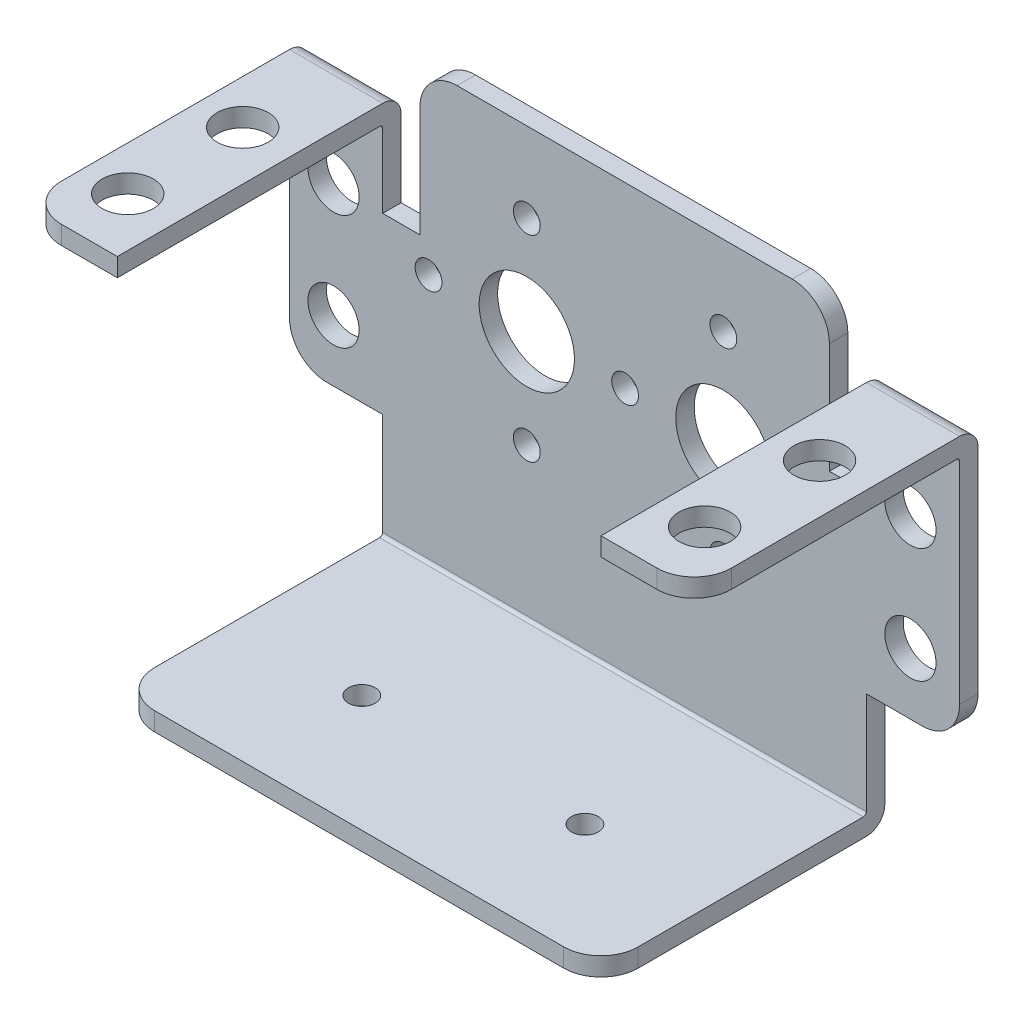
from build123d import *

# Parameters (mm, degrees)
SKETCH1_R      = 4.064
SKETCH1_R_2    = 1.143
SKETCH1_R_3    = 2.1844
EXTRUDE2_DEPTH = 1.5748
SKETCH3_W      = 7.9502
SKETCH3_H      = 1.5748
SKETCH3_W_2    = 41.2496
EXTRUDE3_DEPTH = 22.6314
FILLET1_R      = 3.175
FILLET2_R      = 1.5748
FILLET3_R      = 0.254
SKETCH4_R      = 1.143
EXTRUDE4_DEPTH = 1.5748
SKETCH5_R      = 2.1844
EXTRUDE5_DEPTH = 1.5748


with BuildPart() as part:
    # Sketch1 → Extrude2 (new body)
    with BuildSketch(Plane.XY):
        with BuildLine():
            Line((11.9126, 30.734), (11.9126, 34.835994844))
            ThreePointArc((11.9126, 34.835994844), (12.84253597, 37.081058874), (15.0876, 38.010994844))
            Line((15.0876, 38.010994844), (43.6626, 38.010994844))
            ThreePointArc((43.6626, 38.010994844), (45.90766403, 37.081058874), (46.8376, 34.835994844))
            Line((46.8376, 34.835994844), (46.8376, 33.528))
            Line((46.8376, 33.528), (46.8376, 25.4))
            Line((46.8376, 25.4), (49.9872, 25.4))
            Line((49.9872, 25.4), (49.9872, 33.528))
            Line((49.9872, 33.528), (57.9374, 33.528))
            Line((57.9374, 33.528), (57.9374, 13.716))
            ThreePointArc((57.9374, 13.716), (57.00746403, 11.47093597), (54.7624, 10.541))
            Line((54.7624, 10.541), (49.9872, 10.541))
            Line((49.9872, 10.541), (49.9872, 0))
            Line((49.9872, 0), (8.7376, 0))
            Line((8.7376, 0), (8.7376, 10.541))
            Line((8.7376, 10.541), (3.9624, 10.541))
            ThreePointArc((3.9624, 10.541), (1.71733597, 11.47093597), (0.7874, 13.716))
            Line((0.7874, 13.716), (0.7874, 33.528))
            Line((0.7874, 33.528), (8.7376, 33.528))
            Line((8.7376, 33.528), (8.7376, 25.4))
            Line((8.7376, 25.4), (11.9126, 25.4))
            Line((11.9126, 25.4), (11.9126, 30.734))
        make_face()
        with Locations((21.0312, 22.8092)):
            Circle(SKETCH1_R, mode=Mode.SUBTRACT)
        with Locations((21.0312, 31.1912)):
            Circle(SKETCH1_R_2, mode=Mode.SUBTRACT)
        with Locations((29.4132, 22.8092)):
            Circle(SKETCH1_R_2, mode=Mode.SUBTRACT)
        with Locations((21.0312, 14.4272)):
            Circle(SKETCH1_R_2, mode=Mode.SUBTRACT)
        with Locations((12.6492, 22.8092)):
            Circle(SKETCH1_R_2, mode=Mode.SUBTRACT)
        with Locations((37.7952, 31.1912)):
            Circle(SKETCH1_R_2, mode=Mode.SUBTRACT)
        with Locations((46.1772, 22.8092)):
            Circle(SKETCH1_R_2, mode=Mode.SUBTRACT)
        with Locations((37.7952, 22.8092)):
            Circle(SKETCH1_R, mode=Mode.SUBTRACT)
        with Locations((37.7952, 14.4272)):
            Circle(SKETCH1_R_2, mode=Mode.SUBTRACT)
        with Locations((4.5466, 25.5778)):
            Circle(SKETCH1_R_3, mode=Mode.SUBTRACT)
        with Locations((4.5466, 15.7734)):
            Circle(SKETCH1_R_3, mode=Mode.SUBTRACT)
        with Locations((53.7464, 25.5778)):
            Circle(SKETCH1_R_3, mode=Mode.SUBTRACT)
        with Locations((53.7464, 15.7734)):
            Circle(SKETCH1_R_3, mode=Mode.SUBTRACT)
    extrude(amount=EXTRUDE2_DEPTH)

    # Sketch3 → Extrude3 (add)
    with BuildSketch(Plane.XY.offset(1.5748)):
        with Locations((4.7625, 32.7406)):
            Rectangle(SKETCH3_W, SKETCH3_H)
        with Locations((29.3624, 0.7874)):
            Rectangle(SKETCH3_W_2, SKETCH3_H)
        with Locations((53.9623, 32.7406)):
            Rectangle(SKETCH3_W, SKETCH3_H)
    extrude(amount=EXTRUDE3_DEPTH)

    # Fillet1
    fillet1_edges = [part.edges().sort_by_distance(p)[0] for p in [
        (0.7874, 32.7406, 24.2062),
        (8.7376, 0.7874, 24.2062),
        (49.9872, 0.7874, 24.2062),
        (57.9374, 32.7406, 24.2062),
    ]]
    fillet(fillet1_edges, radius=FILLET1_R)

    # Fillet2
    fillet2_edges = [part.edges().sort_by_distance(p)[0] for p in [
        (4.7625, 33.528, 0),
        (53.9623, 33.528, 0),
        (29.3624, 0, 0),
    ]]
    fillet(fillet2_edges, radius=FILLET2_R)

    # Fillet3
    fillet3_edges = [part.edges().sort_by_distance(p)[0] for p in [
        (4.7625, 31.9532, 1.5748),
        (29.3624, 1.5748, 1.5748),
        (53.9623, 31.9532, 1.5748),
    ]]
    fillet(fillet3_edges, radius=FILLET3_R)

    # Sketch4 → Extrude4 (cut)
    with BuildSketch(Plane.XZ):
        with Locations(Location((19.6342, 14.2494, 0), (0, 0, 270))):
            Circle(SKETCH4_R)
        with Locations(Location((38.6588, 14.2494, 0), (0, 0, 270))):
            Circle(SKETCH4_R)
    extrude(amount=-EXTRUDE4_DEPTH, mode=Mode.SUBTRACT)

    # Sketch5 → Extrude5 (cut)
    with BuildSketch(Plane(origin=(0, 33.528, 0), x_dir=(1, 0, 0), z_dir=(0, 1, 0))):
        with Locations(Location((4.5466, -9.3218, 0), (0, 0, 270))):
            Circle(SKETCH5_R)
        with Locations(Location((4.5466, -19.1262, 0), (0, 0, 270))):
            Circle(SKETCH5_R)
        with Locations(Location((53.7464, -19.1262, 0), (0, 0, 270))):
            Circle(SKETCH5_R)
        with Locations(Location((53.7464, -9.3218, 0), (0, 0, 270))):
            Circle(SKETCH5_R)
    extrude(amount=-EXTRUDE5_DEPTH, mode=Mode.SUBTRACT)


solid = part.part
